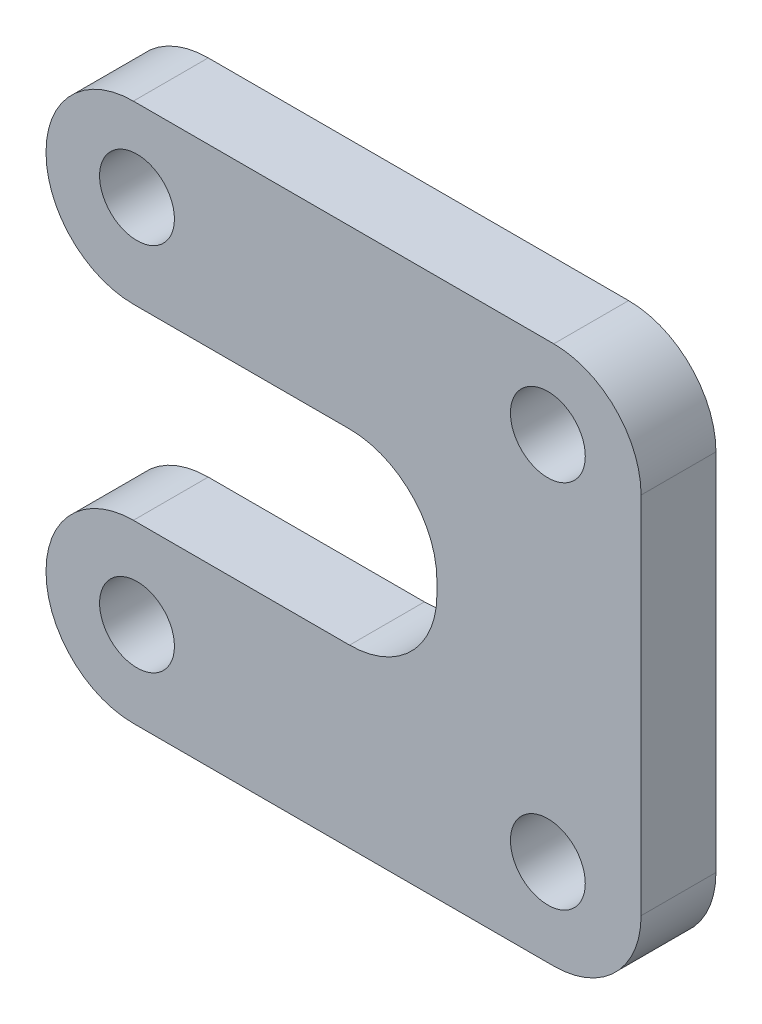
from build123d import *

# Parameters (mm, degrees)
BOSS_EXTRUDE1_DEPTH = 6
SKETCH2_R           = 3
CUT_EXTRUDE1_DEPTH  = 10


with BuildPart() as part:
    # Sketch1 → Boss-Extrude1 (new body)
    with BuildSketch(Plane.XY):
        with BuildLine():
            Line((-96.675181291, 41.529422732), (-96.675181291, 41.429422732))
            ThreePointArc((-96.675181291, 41.429422732), (-94.62492876, 36.479675264), (-89.675181291, 34.429422732))
            Line((-89.675181291, 34.429422732), (-72.346473379, 34.429422732))
            ThreePointArc((-72.346473379, 34.429422732), (-67.396725911, 32.379170201), (-65.346473379, 27.429422732))
            Line((-65.346473379, 27.429422732), (-65.346473379, 26.429422732))
            ThreePointArc((-65.346473379, 26.429422732), (-67.396725911, 21.479675264), (-72.346473379, 19.429422732))
            Line((-72.346473379, 19.429422732), (-89.675181291, 19.429422732))
            ThreePointArc((-89.675181291, 19.429422732), (-94.62492876, 17.379170201), (-96.675181291, 12.429422732))
            Line((-96.675181291, 12.429422732), (-96.675181291, 12.329422732))
            ThreePointArc((-96.675181291, 12.329422732), (-94.62492876, 7.379675264), (-89.675181291, 5.329422732))
            Line((-89.675181291, 5.329422732), (-55.978821898, 5.329422732))
            ThreePointArc((-55.978821898, 5.329422732), (-51.02907443, 7.379675264), (-48.978821898, 12.329422732))
            Line((-48.978821898, 12.329422732), (-48.978821898, 41.529422732))
            ThreePointArc((-48.978821898, 41.529422732), (-51.02907443, 46.479170201), (-55.978821898, 48.529422732))
            Line((-55.978821898, 48.529422732), (-89.675181291, 48.529422732))
            ThreePointArc((-89.675181291, 48.529422732), (-94.62492876, 46.479170201), (-96.675181291, 41.529422732))
        make_face()
    extrude(amount=BOSS_EXTRUDE1_DEPTH)

    # Sketch2 → Cut-Extrude1 (cut)
    with BuildSketch(Plane.XY.offset(6)):
        with Locations((-89.385397691, 41.99084206)):
            Circle(SKETCH2_R)
        with Locations((-56.451908776, 41.99084206)):
            Circle(SKETCH2_R)
        with Locations((-56.451908776, 12.329422732)):
            Circle(SKETCH2_R)
        with Locations((-89.385397691, 12.329422732)):
            Circle(SKETCH2_R)
    extrude(amount=-CUT_EXTRUDE1_DEPTH, mode=Mode.SUBTRACT)


solid = part.part
